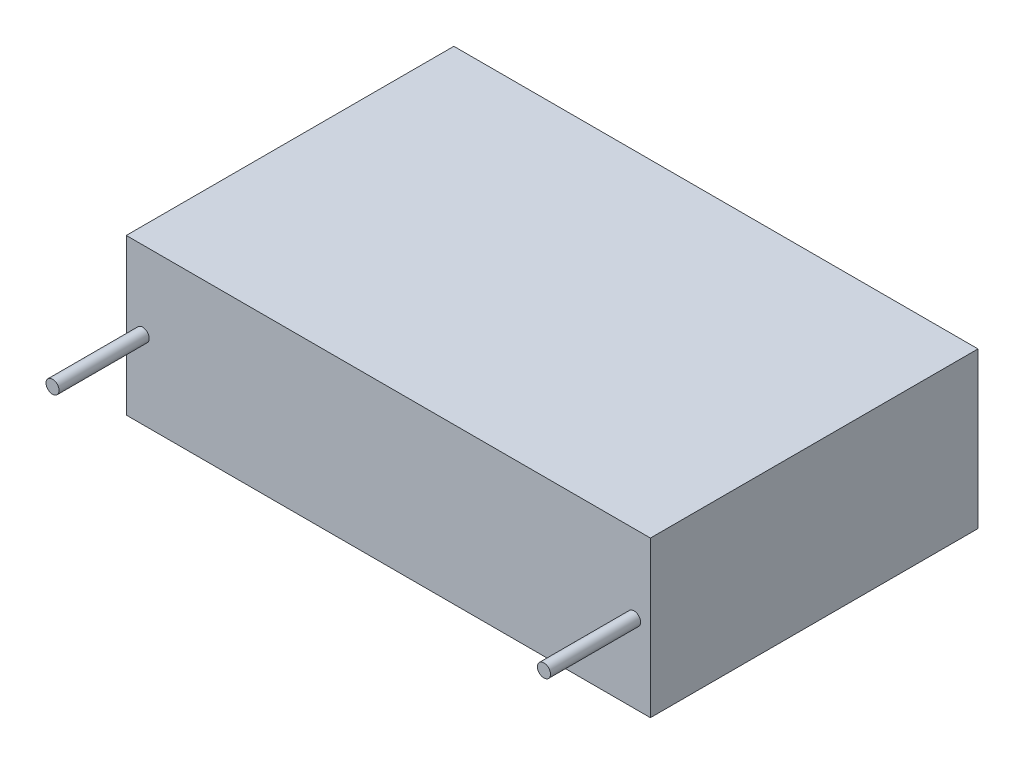
from build123d import *

# Parameters (mm, degrees)
SKETCH_1_W      = 32
SKETCH_1_H      = 9.5
EXTRUDE_1_DEPTH = 20
SKETCH_2_R      = 0.4
EXTRUDE_2_DEPTH = 5.5


with BuildPart() as part:
    # Эскиз1 → Вытянуть1 (new body)
    with BuildSketch(Plane.XY):
        with Locations((16, 4.75)):
            Rectangle(SKETCH_1_W, SKETCH_1_H)
    extrude(amount=EXTRUDE_1_DEPTH)

    # Эскиз2 → Вытянуть2 (add)
    with BuildSketch(Plane.XY.offset(20)):
        with Locations(Location((1, 4.75, 0), (0, 0, 180))):
            Circle(SKETCH_2_R)
        with Locations(Location((31, 4.75, 0), (0, 0, 180))):
            Circle(SKETCH_2_R)
    extrude(amount=EXTRUDE_2_DEPTH)


solid = part.part
